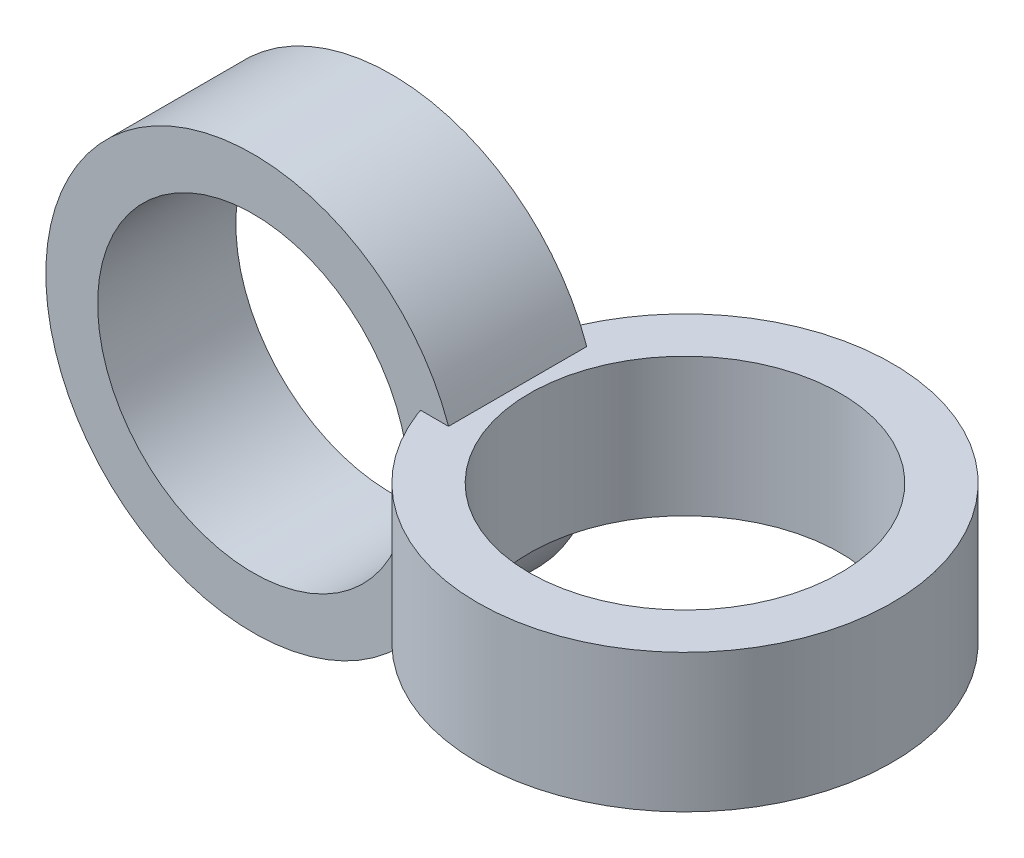
from build123d import *

# Parameters (mm, degrees)
BOSS_EXTRUDE1_DEPTH      = 32
BOSS_EXTRUDE1_DEPTH_BACK = 32
SKETCH1_R                = 96
SKETCH1_R_2              = 72
BOSS_EXTRUDE2_DEPTH      = 32
BOSS_EXTRUDE2_DEPTH_BACK = 32
SKETCH2_R                = 96
SKETCH2_R_2              = 72


with BuildPart() as part:
    # Sketch1 → Boss-Extrude1 (new, two sides: drawn at the far end of the back side and taken through both)
    with BuildSketch(Plane.XY.offset(-BOSS_EXTRUDE1_DEPTH_BACK)):
        Circle(SKETCH1_R)
        Circle(SKETCH1_R_2, mode=Mode.SUBTRACT)
    extrude(amount=BOSS_EXTRUDE1_DEPTH + BOSS_EXTRUDE1_DEPTH_BACK)


with BuildPart() as body_2:
    # Sketch2 → Boss-Extrude2 (new, two sides: drawn at the far end of the back side and taken through both)
    with BuildSketch(Plane(origin=(0, 0, 0), x_dir=(1, 0, 0), z_dir=(0, 1, 0)).offset(-BOSS_EXTRUDE2_DEPTH_BACK)):
        with Locations((168, 0)):
            Circle(SKETCH2_R)
        with Locations((168, 0)):
            Circle(SKETCH2_R_2, mode=Mode.SUBTRACT)
    extrude(amount=BOSS_EXTRUDE2_DEPTH + BOSS_EXTRUDE2_DEPTH_BACK)


solid = Compound([part.part, body_2.part])
